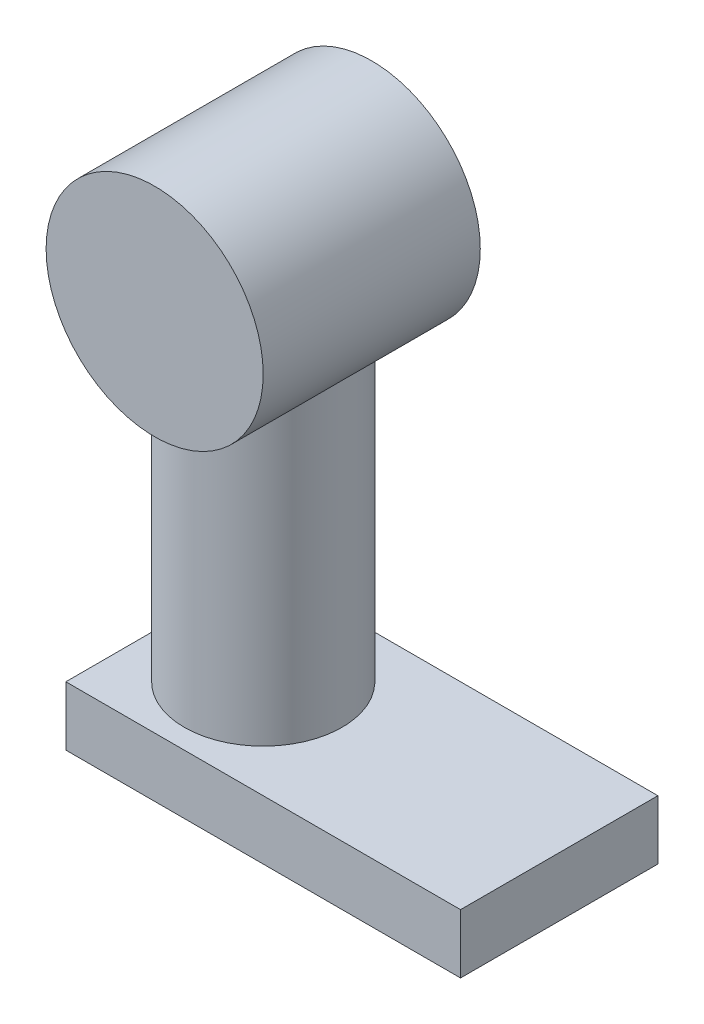
from build123d import *

# Parameters (mm, degrees)
SKETCH1_R           = 40
BOSS_EXTRUDE1_DEPTH = 190
SKETCH2_R           = 55
BOSS_EXTRUDE2_DEPTH = 55
SKETCH3_W           = 200
SKETCH3_H           = 100
BOSS_EXTRUDE3_DEPTH = 30


with BuildPart() as part:
    # Sketch1 → Boss-Extrude1 (new body)
    with BuildSketch(Plane(origin=(0, 0, 0), x_dir=(1, 0, 0), z_dir=(0, 1, 0))):
        Circle(SKETCH1_R)
    extrude(amount=BOSS_EXTRUDE1_DEPTH)

    # Sketch2 → Boss-Extrude2 (add, symmetric)
    with BuildSketch(Plane.XY):
        with Locations((0, 190)):
            Circle(SKETCH2_R)
    extrude(amount=BOSS_EXTRUDE2_DEPTH, both=True)

    # Sketch3 → Boss-Extrude3 (add)
    with BuildSketch(Plane.XZ):
        with Locations((50, 0)):
            Rectangle(SKETCH3_W, SKETCH3_H)
    extrude(amount=BOSS_EXTRUDE3_DEPTH)


solid = part.part
